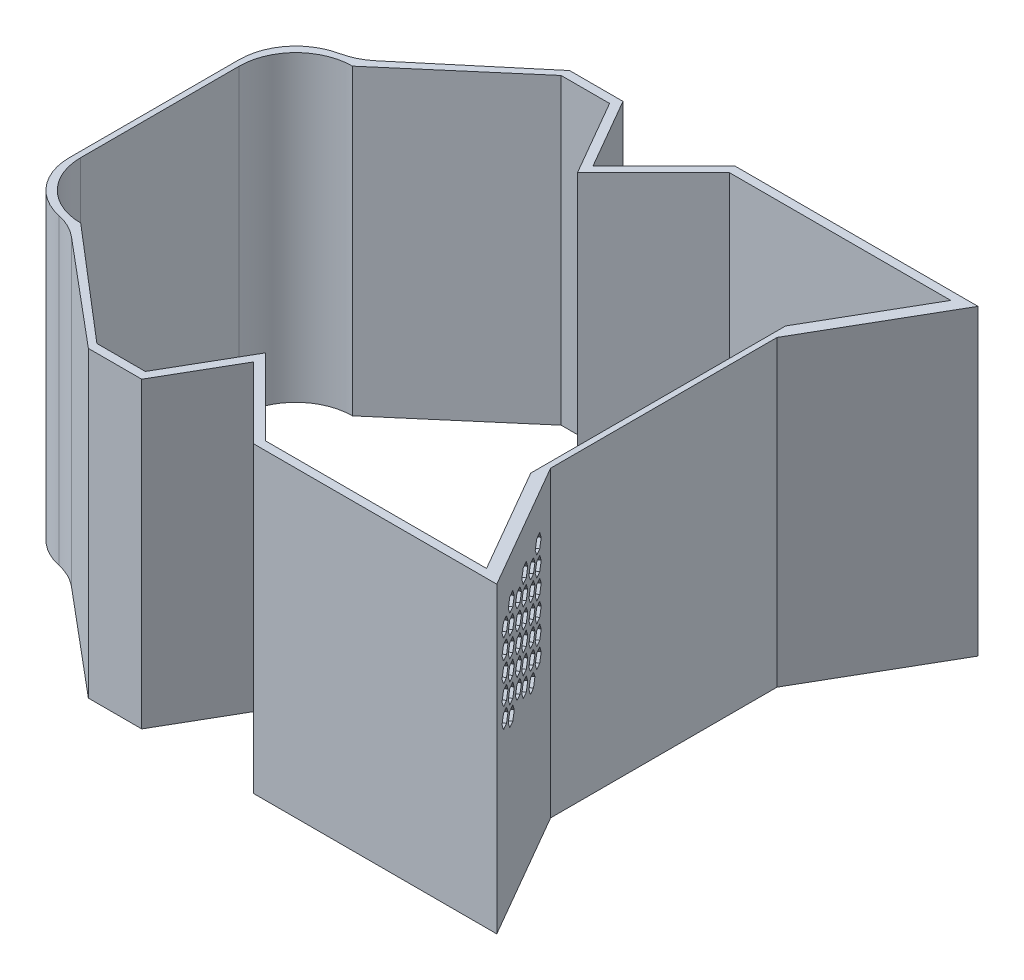
from build123d import *

# Parameters (mm, degrees)
Y_KSEKLIK_EKSTR_ZYON1_DEPTH = 107
KES_EKSTR_ZYON1_DEPTH       = 4.3


with BuildPart() as part:
    # Çizim1 → Yükseklik-Ekstrüzyon1 (new body)
    with BuildSketch(Plane(origin=(0, 0, 0), x_dir=(1, 0, 0), z_dir=(0, 1, 0))):
        with BuildLine():
            Line((-90, -30), (-90, 30))
            ThreePointArc((-90, 30), (-85.543919717, 42.58517222), (-74.161344018, 49.562290662))
            ThreePointArc((-74.161344018, 49.562290662), (-69.553836163, 51.149397409), (-65.466935843, 53.803692463))
            Line((-65.466935843, 53.803692463), (-28.288624259, 85))
            Line((-28.288624259, 85), (-9.43375673, 85))
            Line((-9.43375673, 85), (5, 60))
            Line((5, 60), (30, 85))
            Line((30, 85), (115.980762114, 85))
            Line((115.980762114, 85), (90, 40))
            Line((90, 40), (90, -40))
            Line((90, -40), (115.980762114, -85))
            Line((115.980762114, -85), (30, -85))
            Line((30, -85), (5, -60))
            Line((5, -60), (-9.43375673, -85))
            Line((-9.43375673, -85), (-28.288624259, -85))
            Line((-28.288624259, -85), (-65.466935843, -53.803692463))
            ThreePointArc((-65.466935843, -53.803692463), (-69.553836163, -51.149397409), (-74.161344018, -49.562290662))
            ThreePointArc((-74.161344018, -49.562290662), (-85.543919717, -42.58517222), (-90, -30))
        make_face()
        with BuildLine():
            Line((19.621320344, -70.378679656), (4.356761848, -55.114121161))
            Line((4.356761848, -55.114121161), (-4.814954576, -71))
            Line((-4.814954576, -71), (-11.165807537, -82))
            Line((-11.165807537, -82), (-28.288624259, -82))
            Line((-28.288624259, -82), (-68, -48))
            ThreePointArc((-68, -48), (-82.142135624, -42.142135624), (-88, -28))
            Line((-88, -28), (-88, 28))
            ThreePointArc((-88, 28), (-82.142135624, 42.142135624), (-68, 48))
            Line((-68, 48), (-28.288624259, 82))
            Line((-28.288624259, 82), (-11.165807537, 82))
            Line((-11.165807537, 82), (-4.814954576, 71))
            Line((-4.814954576, 71), (4.356761848, 55.114121161))
            Line((4.356761848, 55.114121161), (19.621320344, 70.378679656))
            Line((19.621320344, 70.378679656), (31.242640687, 82))
            Line((31.242640687, 82), (109.36195996, 82))
            Line((109.36195996, 82), (88, 45))
            Line((88, 45), (88, 38))
            Line((88, 38), (88, 0))
            Line((88, 0), (88, -38))
            Line((88, -38), (88, -45))
            Line((88, -45), (109.36195996, -82))
            Line((109.36195996, -82), (31.242640687, -82))
            Line((31.242640687, -82), (19.621320344, -70.378679656))
        make_face(mode=Mode.SUBTRACT)
    extrude(amount=Y_KSEKLIK_EKSTR_ZYON1_DEPTH)

    # Çizim2 → Kes-Ekstrüzyon1 (cut)
    with BuildSketch(Plane(origin=(50.179491924, 0, -28.97114317), x_dir=(-0.5000000000000016, 0, -0.8660254037844378), z_dir=(0.8660254037844378, 0, -0.5000000000000016))):
        Polygon((-94.777240917, 67.5), (-96.22061659, 65), (-99.107367936, 65), (-100.550743609, 67.5), (-99.107367936, 70), (-96.22061659, 70), align=None)
        Polygon((-88.715789032, 71), (-90.159164705, 68.5), (-93.045916051, 68.5), (-94.489291724, 71), (-93.045916051, 73.5), (-90.159164705, 73.5), align=None)
        Polygon((-99.107367936, 72), (-96.22061659, 72), (-94.777240917, 74.5), (-96.22061659, 77), (-99.107367936, 77), (-100.550743609, 74.5), align=None)
        Polygon((-88.715789032, 78), (-90.159164705, 75.5), (-93.045916051, 75.5), (-94.489291724, 78), (-93.045916051, 80.5), (-90.159164705, 80.5), align=None)
        Polygon((-94.777240917, 81.5), (-96.22061659, 79), (-99.107367936, 79), (-100.550743609, 81.5), (-99.107367936, 84), (-96.22061659, 84), align=None)
        Polygon((-93.045916051, 82.5), (-90.159164705, 82.5), (-88.715789032, 85), (-90.159164705, 87.5), (-93.045916051, 87.5), (-94.489291724, 85), align=None)
        Polygon((-93.045916051, 89.5), (-90.159164705, 89.5), (-88.715789032, 92), (-90.159164705, 94.5), (-93.045916051, 94.5), (-94.489291724, 92), align=None)
        Polygon((-99.107458683, 85.999842831), (-96.220707337, 85.999842831), (-94.777331664, 88.499842831), (-96.220707337, 90.999842831), (-99.107458683, 90.999842831), (-100.550834356, 88.499842831), align=None)
        Polygon((-106.045916051, 89.5), (-103.159164705, 89.5), (-101.715789032, 92), (-103.159164705, 94.5), (-106.045916051, 94.5), (-107.489291724, 92), align=None)
        Polygon((-106.045916051, 82.5), (-103.159164705, 82.5), (-101.715789032, 85), (-103.159164705, 87.5), (-106.045916051, 87.5), (-107.489291724, 85), align=None)
        Polygon((-112.107458683, 85.999842831), (-109.220707337, 85.999842831), (-107.777331664, 88.499842831), (-109.220707337, 90.999842831), (-112.107458683, 90.999842831), (-113.550834356, 88.499842831), align=None)
        Polygon((-107.777240917, 81.5), (-109.22061659, 79), (-112.107367936, 79), (-113.550743609, 81.5), (-112.107367936, 84), (-109.22061659, 84), align=None)
        Polygon((-101.715789032, 78), (-103.159164705, 75.5), (-106.045916051, 75.5), (-107.489291724, 78), (-106.045916051, 80.5), (-103.159164705, 80.5), align=None)
        Polygon((-114.715789032, 78), (-116.159164705, 75.5), (-119.045916051, 75.5), (-120.489291724, 78), (-119.045916051, 80.5), (-116.159164705, 80.5), align=None)
        Polygon((-125.107458683, 85.999842831), (-122.220707337, 85.999842831), (-120.777331664, 88.499842831), (-122.220707337, 90.999842831), (-125.107458683, 90.999842831), (-126.550834356, 88.499842831), align=None)
        Polygon((-119.045916051, 82.5), (-116.159164705, 82.5), (-114.715789032, 85), (-116.159164705, 87.5), (-119.045916051, 87.5), (-120.489291724, 85), align=None)
        Polygon((-119.045916051, 89.5), (-116.159164705, 89.5), (-114.715789032, 92), (-116.159164705, 94.5), (-119.045916051, 94.5), (-120.489291724, 92), align=None)
        Polygon((-120.777240917, 81.5), (-122.22061659, 79), (-125.107367936, 79), (-126.550743609, 81.5), (-125.107367936, 84), (-122.22061659, 84), align=None)
        Polygon((-101.715789032, 71), (-103.159164705, 68.5), (-106.045916051, 68.5), (-107.489291724, 71), (-106.045916051, 73.5), (-103.159164705, 73.5), align=None)
        Polygon((-99.107367936, 58.001257369), (-96.22061659, 58.001257369), (-94.777240917, 60.501257369), (-96.22061659, 63.001257369), (-99.107367936, 63.001257369), (-100.550743609, 60.501257369), align=None)
        Polygon((-93.045916051, 61.5), (-90.159164705, 61.5), (-88.715789032, 64), (-90.159164705, 66.5), (-93.045916051, 66.5), (-94.489291724, 64), align=None)
        Polygon((-120.777240917, 74.5), (-122.22061659, 77), (-125.107367936, 77), (-126.550743609, 74.5), (-125.107367936, 72), (-122.22061659, 72), align=None)
        Polygon((-116.159164705, 73.5), (-114.715789032, 71), (-116.159164705, 68.5), (-119.045916051, 68.5), (-120.489291724, 71), (-119.045916051, 73.5), align=None)
        Polygon((-109.22061659, 72), (-107.777240917, 74.5), (-109.22061659, 77), (-112.107367936, 77), (-113.550743609, 74.5), (-112.107367936, 72), align=None)
        Polygon((-109.22061659, 70), (-107.777240917, 67.5), (-109.22061659, 65), (-112.107367936, 65), (-113.550743609, 67.5), (-112.107367936, 70), align=None)
        Polygon((-101.715789032, 64), (-103.159164705, 66.5), (-106.045916051, 66.5), (-107.489291724, 64), (-106.045916051, 61.5), (-103.159164705, 61.5), align=None)
        Polygon((-93.045916051, 59.5), (-94.489291724, 57), (-93.045916051, 54.5), (-90.159164705, 54.5), (-88.715789032, 57), (-90.159164705, 59.5), align=None)
        Polygon((-96.22061659, 56.001257369), (-94.777240917, 53.501257369), (-96.22061659, 51.001257369), (-99.107367936, 51.001257369), (-100.550743609, 53.501257369), (-99.107367936, 56.001257369), align=None)
        Polygon((-101.715789032, 57), (-103.159164705, 59.5), (-106.045916051, 59.5), (-107.489291724, 57), (-106.045916051, 54.5), (-103.159164705, 54.5), align=None)
        Polygon((-116.159164705, 61.5), (-114.715789032, 64), (-116.159164705, 66.5), (-119.045916051, 66.5), (-120.489291724, 64), (-119.045916051, 61.5), align=None)
        Polygon((-122.22061659, 70), (-120.777240917, 67.5), (-122.22061659, 65), (-125.107367936, 65), (-126.550743609, 67.5), (-125.107367936, 70), align=None)
        Polygon((-122.22061659, 58.001257369), (-120.777240917, 60.501257369), (-122.22061659, 63.001257369), (-125.107367936, 63.001257369), (-126.550743609, 60.501257369), (-125.107367936, 58.001257369), align=None)
        Polygon((-114.715789032, 57), (-116.159164705, 59.5), (-119.045916051, 59.5), (-120.489291724, 57), (-119.045916051, 54.5), (-116.159164705, 54.5), align=None)
        Polygon((-112.107367936, 63.001257369), (-113.550743609, 60.501257369), (-112.107367936, 58.001257369), (-109.22061659, 58.001257369), (-107.777240917, 60.501257369), (-109.22061659, 63.001257369), align=None)
    extrude(amount=-KES_EKSTR_ZYON1_DEPTH, mode=Mode.SUBTRACT)


solid = part.part
